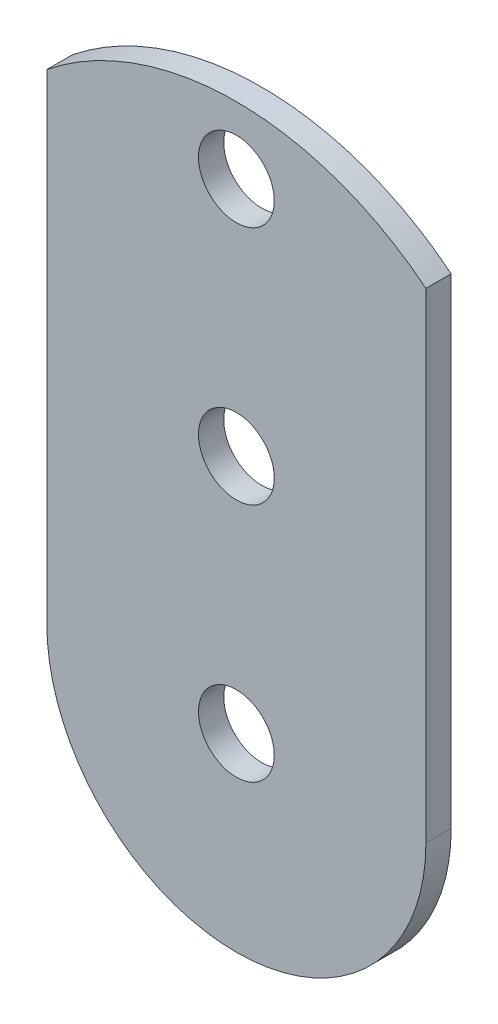
from build123d import *

# Parameters (mm, degrees)
SKETCH_1_R      = 3
EXTRUDE_1_DEPTH = 2


with BuildPart() as part:
    # 草图1 → 凸台-拉伸1 (new body)
    with BuildSketch(Plane.XY):
        with BuildLine():
            Line((14.741955886, -3.055110285), (14.741955886, -41.055110285))
            ThreePointArc((14.741955886, -41.055110285), (-0.258044114, -56.055110285), (-15.258044114, -41.055110285))
            Line((-15.258044114, -41.055110285), (-15.258044114, -3.055110285))
            ThreePointArc((-15.258044114, -3.055110285), (-0.258044114, 2.246640552), (14.741955886, -3.055110285))
        make_face()
        with Locations((-0.258044114, -3.055110285)):
            Circle(SKETCH_1_R, mode=Mode.SUBTRACT)
        with Locations((-0.258044114, -22.055110285)):
            Circle(SKETCH_1_R, mode=Mode.SUBTRACT)
        with Locations((-0.258044114, -41.055110285)):
            Circle(SKETCH_1_R, mode=Mode.SUBTRACT)
    extrude(amount=EXTRUDE_1_DEPTH)


solid = part.part
